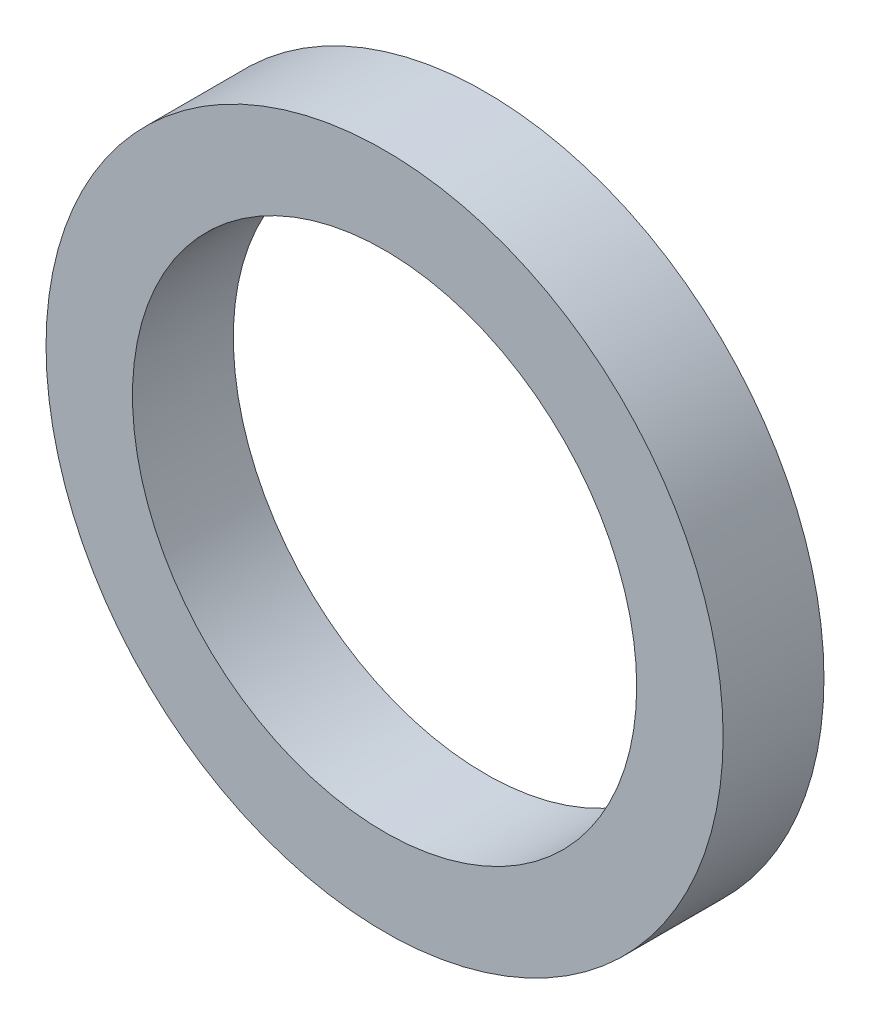
from build123d import *

# Parameters (mm, degrees)
SKETCH_1_R      = 23.5
SKETCH_1_R_2    = 17.5
EXTRUDE_1_DEPTH = 7


with BuildPart() as part:
    # 草图1 → 凸台-拉伸1 (new body)
    with BuildSketch(Plane.XY):
        Circle(SKETCH_1_R)
        Circle(SKETCH_1_R_2, mode=Mode.SUBTRACT)
    extrude(amount=EXTRUDE_1_DEPTH)


solid = part.part
